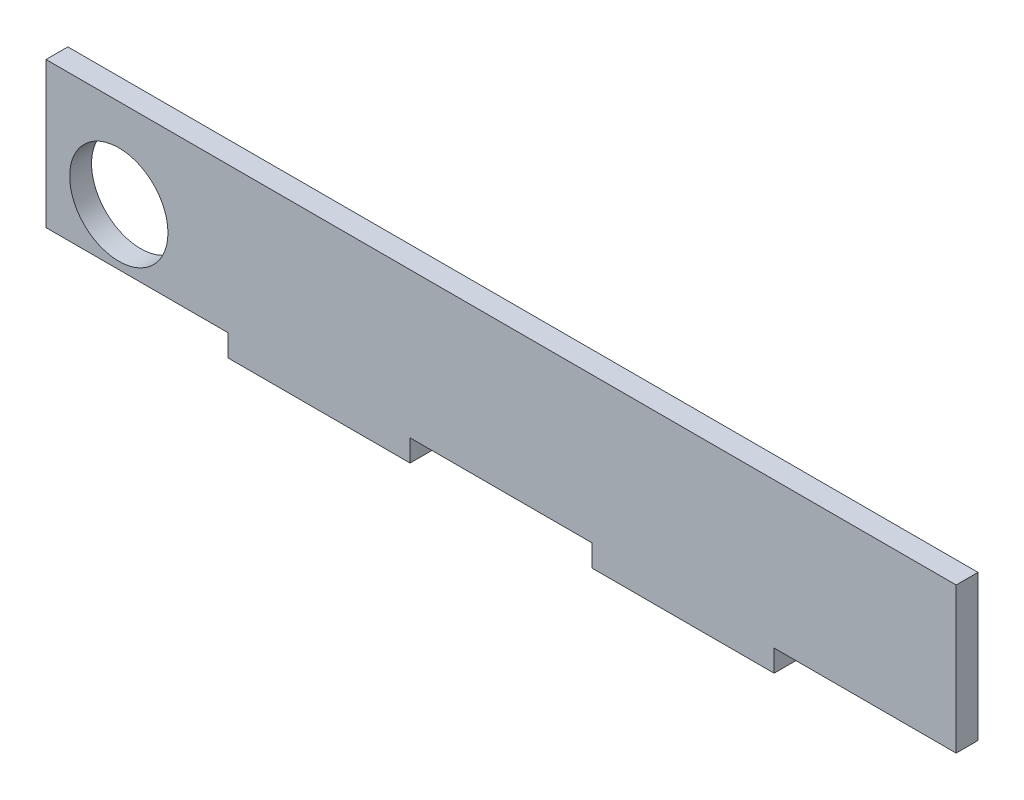
from build123d import *

# Parameters (mm, degrees)
SKETCH1_W           = 250
SKETCH1_H           = 46
BOSS_EXTRUDE1_DEPTH = 6
SKETCH2_W           = 50
SKETCH2_H           = 6
CUT_EXTRUDE1_DEPTH  = 6
SKETCH3_R           = 13.5
CUT_EXTRUDE2_DEPTH  = 10


with BuildPart() as part:
    # Sketch1 → Boss-Extrude1 (new body)
    with BuildSketch(Plane.XY):
        Rectangle(SKETCH1_W, SKETCH1_H)
    extrude(amount=BOSS_EXTRUDE1_DEPTH)

    # Sketch2 → Cut-Extrude1 (cut)
    with BuildSketch(Plane.XY.offset(6)):
        with Locations((0, -20)):
            Rectangle(SKETCH2_W, SKETCH2_H)
        with Locations((-100, -20)):
            Rectangle(SKETCH2_W, SKETCH2_H)
        with Locations((100, -20)):
            Rectangle(SKETCH2_W, SKETCH2_H)
    extrude(amount=-CUT_EXTRUDE1_DEPTH, mode=Mode.SUBTRACT)

    # Sketch3 → Cut-Extrude2 (cut)
    with BuildSketch(Plane.XY.offset(6)):
        with Locations((-105, -1.5)):
            Circle(SKETCH3_R)
    extrude(amount=-CUT_EXTRUDE2_DEPTH, mode=Mode.SUBTRACT)


solid = part.part
